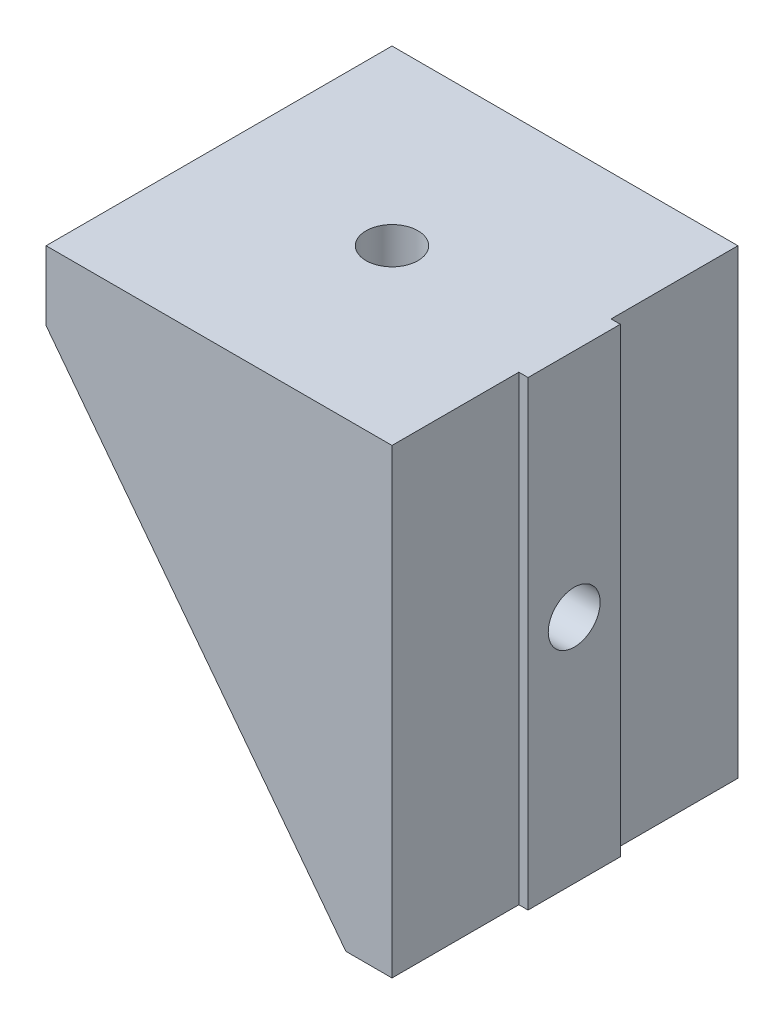
from build123d import *

# Parameters (mm, degrees)
BOSS_EXTRUDE1_DEPTH = 15
SKETCH2_W           = 8
SKETCH2_H           = 40
BOSS_EXTRUDE2_DEPTH = 0.8
SKETCH3_W           = 26
SKETCH3_H           = 34
CUT_EXTRUDE1_DEPTH  = 10
SKETCH4_R           = 2.25
CUT_EXTRUDE2_DEPTH  = 51.009999
SKETCH5_R           = 2.25
CUT_EXTRUDE3_DEPTH  = 53.201532545


with BuildPart() as part:
    # Sketch1 → Boss-Extrude1 (new, symmetric)
    with BuildSketch(Plane.XY):
        Polygon((0, 0), (-30, 0), (-30, -6), (-4, -40), (0, -40), align=None)
    extrude(amount=BOSS_EXTRUDE1_DEPTH, both=True)

    # Sketch2 → Boss-Extrude2 (add)
    with BuildSketch(Plane(origin=(0, 0, 0), x_dir=(0, 0, -1), z_dir=(1, 0, 0))):
        with Locations((0, -20)):
            Rectangle(SKETCH2_W, SKETCH2_H)
    extrude(amount=BOSS_EXTRUDE2_DEPTH)

    # Sketch3 → Cut-Extrude1 (cut, symmetric)
    with BuildSketch(Plane.XY):
        with Locations((-17, -23)):
            Rectangle(SKETCH3_W, SKETCH3_H)
    extrude(amount=CUT_EXTRUDE1_DEPTH, both=True, mode=Mode.SUBTRACT)

    # Sketch4 → Cut-Extrude2 (cut, through all)
    with BuildSketch(Plane.ZY.offset(4)):
        with Locations((0, -20)):
            Circle(SKETCH4_R)
    extrude(amount=-CUT_EXTRUDE2_DEPTH, mode=Mode.SUBTRACT)

    # Sketch5 → Cut-Extrude3 (cut, through all)
    with BuildSketch(Plane(origin=(0, 0, 0), x_dir=(1, 0, 0), z_dir=(0, 1, 0))):
        with Locations(Location((-15, 0, 0), (0, 0, 270))):
            Circle(SKETCH5_R)
    extrude(amount=-CUT_EXTRUDE3_DEPTH, mode=Mode.SUBTRACT)


solid = part.part
